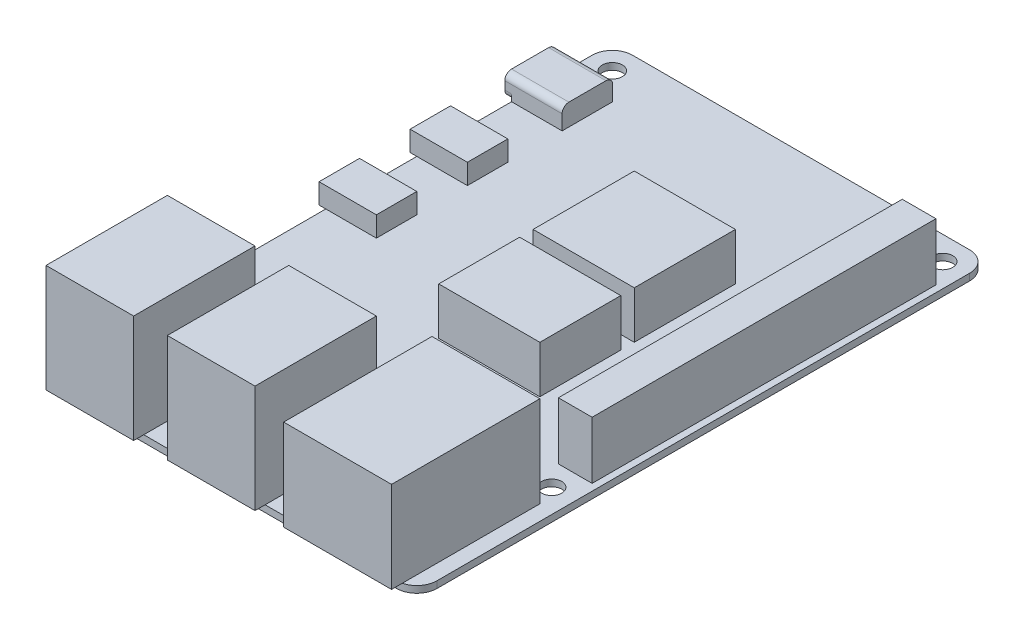
from build123d import *

# Parameters (mm, degrees)
ESQUISSE1_R        = 1.5
BOSS_EXTRU_1_DEPTH = 1
ESQUISSE2_W        = 13
ESQUISSE2_H        = 18
BOSS_EXTRU_2_DEPTH = 16
ESQUISSE3_W        = 16
ESQUISSE3_H        = 22
BOSS_EXTRU_3_DEPTH = 13.5
ESQUISSE4_W        = 15
ESQUISSE4_H        = 15
ESQUISSE4_H_2      = 12
BOSS_EXTRU_4_DEPTH = 7
ESQUISSE5_W        = 8.5
ESQUISSE5_H        = 7.5
BOSS_EXTRU_5_DEPTH = 3.2
CONG_3_R           = 1
CONG_4_R           = 1
ESQUISSE6_W        = 8.5
ESQUISSE6_H        = 6
BOSS_EXTRU_6_DEPTH = 3
ESQUISSE7_W        = 5
ESQUISSE7_H        = 51
BOSS_EXTRU_7_DEPTH = 8.5


with BuildPart() as part:
    # Esquisse1 → Boss.-Extru.1 (new body)
    with BuildSketch(Plane(origin=(0, 0, 0), x_dir=(1, 0, 0), z_dir=(0, 1, 0))):
        with BuildLine():
            Line((-25, -42.5), (25, -42.5))
            ThreePointArc((25, -42.5), (27.121320344, -41.621320344), (28, -39.5))
            Line((28, -39.5), (28, 39.5))
            ThreePointArc((28, 39.5), (27.121320344, 41.621320344), (25, 42.5))
            Line((25, 42.5), (-25, 42.5))
            ThreePointArc((-25, 42.5), (-27.121320344, 41.621320344), (-28, 39.5))
            Line((-28, 39.5), (-28, -39.5))
            ThreePointArc((-28, -39.5), (-27.121320344, -41.621320344), (-25, -42.5))
        make_face()
        with Locations(Location((-24.5, 39, 0), (0, 0, 270))):
            Circle(ESQUISSE1_R, mode=Mode.SUBTRACT)
        with Locations(Location((24.5, 39, 0), (0, 0, 270))):
            Circle(ESQUISSE1_R, mode=Mode.SUBTRACT)
        with Locations(Location((-24.5, -19, 0), (0, 0, 270))):
            Circle(ESQUISSE1_R, mode=Mode.SUBTRACT)
        with Locations(Location((24.5, -19, 0), (0, 0, 270))):
            Circle(ESQUISSE1_R, mode=Mode.SUBTRACT)
    extrude(amount=BOSS_EXTRU_1_DEPTH)

    # Esquisse2 → Boss.-Extru.2 (add)
    with BuildSketch(Plane(origin=(0, 1, 0), x_dir=(1, 0, 0), z_dir=(0, 1, 0))):
        with Locations((-19, -35)):
            Rectangle(ESQUISSE2_W, ESQUISSE2_H)
        with Locations((-1, -35)):
            Rectangle(ESQUISSE2_W, ESQUISSE2_H)
    extrude(amount=BOSS_EXTRU_2_DEPTH)

    # Esquisse3 → Boss.-Extru.3 (add)
    with BuildSketch(Plane(origin=(0, 1, 0), x_dir=(1, 0, 0), z_dir=(0, 1, 0))):
        with Locations((17.75, -33)):
            Rectangle(ESQUISSE3_W, ESQUISSE3_H)
    extrude(amount=BOSS_EXTRU_3_DEPTH)

    # Esquisse4 → Boss.-Extru.4 (add)
    with BuildSketch(Plane(origin=(0, 1, 0), x_dir=(1, 0, 0), z_dir=(0, 1, 0))):
        with Locations((4.5, 13.25)):
            Rectangle(ESQUISSE4_W, ESQUISSE4_H)
        with Locations((4.5, -2.25)):
            Rectangle(ESQUISSE4_W, ESQUISSE4_H_2)
    extrude(amount=BOSS_EXTRU_4_DEPTH)

    # Esquisse5 → Boss.-Extru.5 (add)
    with BuildSketch(Plane(origin=(0, 1, 0), x_dir=(1, 0, 0), z_dir=(0, 1, 0))):
        with Locations((-24.75, 31.3)):
            Rectangle(ESQUISSE5_W, ESQUISSE5_H)
    extrude(amount=BOSS_EXTRU_5_DEPTH)

    # Congé3
    cong_3_edges = [part.edges().sort_by_distance(p)[0] for p in [
        (-24.75, 4.2, -27.55),
        (-24.75, 4.2, -35.05),
    ]]
    fillet(cong_3_edges, radius=CONG_3_R)

    # Congé4
    cong_4_edges = [part.edges().sort_by_distance(p)[0] for p in [
        (-28.5, 1, -27.55),
        (-28.5, 1, -35.05),
    ]]
    fillet(cong_4_edges, radius=CONG_4_R)

    # Esquisse6 → Boss.-Extru.6 (add)
    with BuildSketch(Plane(origin=(0, 1, 0), x_dir=(1, 0, 0), z_dir=(0, 1, 0))):
        with Locations((-24.75, 16.5)):
            Rectangle(ESQUISSE6_W, ESQUISSE6_H)
        with Locations((-24.75, 3)):
            Rectangle(ESQUISSE6_W, ESQUISSE6_H)
    extrude(amount=BOSS_EXTRU_6_DEPTH)

    # Esquisse7 → Boss.-Extru.7 (add)
    with BuildSketch(Plane(origin=(0, 1, 0), x_dir=(1, 0, 0), z_dir=(0, 1, 0))):
        with Locations((24.5, 10)):
            Rectangle(ESQUISSE7_W, ESQUISSE7_H)
    extrude(amount=BOSS_EXTRU_7_DEPTH)


solid = part.part
